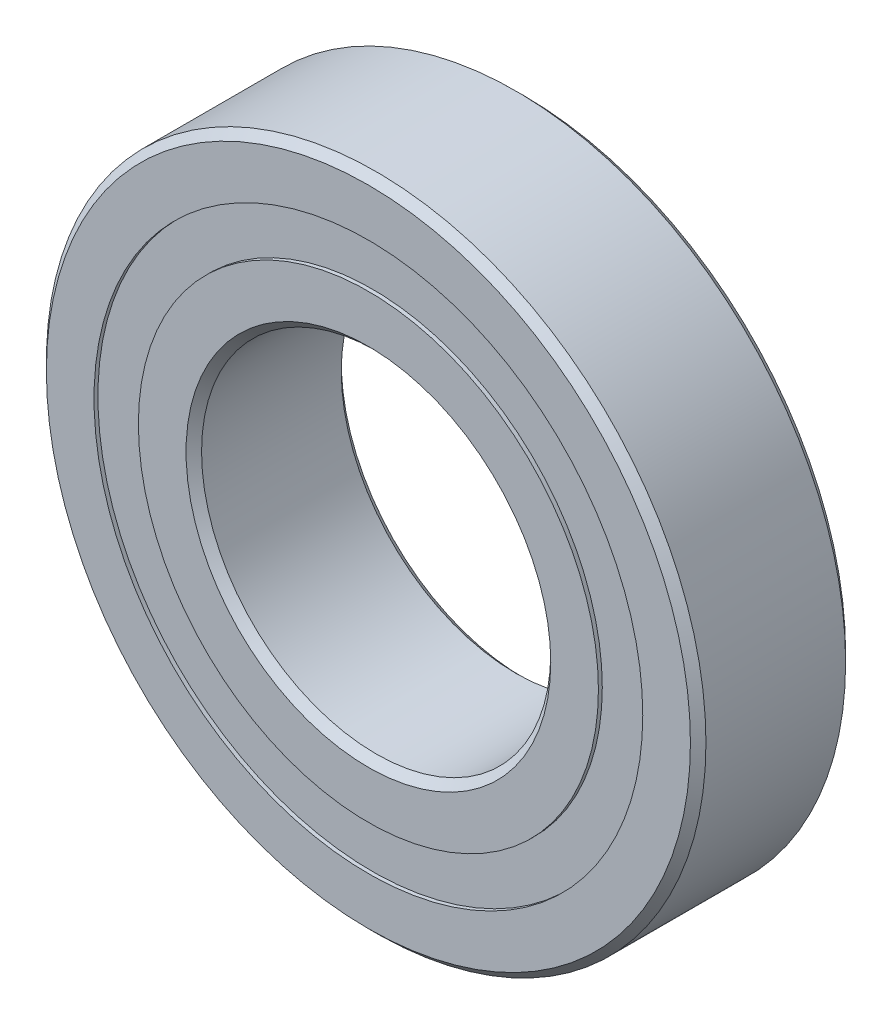
from build123d import *

# Parameters (mm, degrees)
CIRPATTERN1_COUNT = 12
SKETCH5_W         = 2.677418641
SKETCH5_H         = 3.628571428


with BuildPart() as part:
    # Sketch1 → Revolve1 (revolve)
    with BuildSketch(Plane(origin=(0, 0, 0), x_dir=(0, 0, -1), z_dir=(1, 0, 0))):
        with BuildLine():
            Line((5.715, 26.9875), (-5.715, 26.9875))
            Line((-5.715, 26.9875), (-6.35, 26.3525))
            Line((-6.35, 26.3525), (-6.35, 22.451785714))
            Line((-6.35, 22.451785714), (-2.822222222, 22.451785714))
            ThreePointArc((-2.822222222, 22.451785714), (0, 23.992581359), (2.822222222, 22.451785714))
            Line((2.822222222, 22.451785714), (6.35, 22.451785714))
            Line((6.35, 22.451785714), (6.35, 26.3525))
            Line((6.35, 26.3525), (5.715, 26.9875))
        make_face()
    revolve(axis=Axis((0, 0, 6.35), (0, 0, -1)))


with BuildPart() as body_2:
    # Sketch3 → Revolve3 (revolve)
    with BuildSketch(Plane(origin=(0, 0, 0), x_dir=(0, 0, -1), z_dir=(1, 0, 0))):
        with BuildLine():
            Line((-6.35, 18.823214286), (-2.822222222, 18.823214286))
            ThreePointArc((-2.822222222, 18.823214286), (0, 17.282418641), (2.822222222, 18.823214286))
            Line((2.822222222, 18.823214286), (6.35, 18.823214286))
            Line((6.35, 18.823214286), (6.35, 14.9225))
            Line((6.35, 14.9225), (5.715, 14.2875))
            Line((5.715, 14.2875), (-5.715, 14.2875))
            Line((-5.715, 14.2875), (-6.35, 14.9225))
            Line((-6.35, 14.9225), (-6.35, 18.823214286))
        make_face()
    revolve(axis=Axis((0, 0, 6.35), (0, 0, -1)))


with BuildPart() as body_3:
    # Sketch4 → Revolve4 (revolve)
    with BuildSketch(Plane(origin=(0, 0, 0), x_dir=(0, 0, -1), z_dir=(1, 0, 0))):
        with BuildLine():
            Line((-3.355081359, 20.6375), (3.355081359, 20.6375))
            ThreePointArc((3.355081359, 20.6375), (0, 23.992581359), (-3.355081359, 20.6375))
        make_face()
    revolve(axis=Axis((0, 20.6375, 3.355081359), (0, 0, -1)))


with BuildPart() as cirpattern1_1:
    # CirPattern1: pattern copy
    add(body_3.part.rotate(Axis((0, 0, -6.35), (0, 0, 1)), 1 * 360 / CIRPATTERN1_COUNT))


with BuildPart() as cirpattern1_2:
    # CirPattern1: pattern copy
    add(body_3.part.rotate(Axis((0, 0, -6.35), (0, 0, 1)), 2 * 360 / CIRPATTERN1_COUNT))


with BuildPart() as cirpattern1_3:
    # CirPattern1: pattern copy
    add(body_3.part.rotate(Axis((0, 0, -6.35), (0, 0, 1)), 3 * 360 / CIRPATTERN1_COUNT))


with BuildPart() as cirpattern1_4:
    # CirPattern1: pattern copy
    add(body_3.part.rotate(Axis((0, 0, -6.35), (0, 0, 1)), 4 * 360 / CIRPATTERN1_COUNT))


with BuildPart() as cirpattern1_5:
    # CirPattern1: pattern copy
    add(body_3.part.rotate(Axis((0, 0, -6.35), (0, 0, 1)), 5 * 360 / CIRPATTERN1_COUNT))


with BuildPart() as cirpattern1_6:
    # CirPattern1: pattern copy
    add(body_3.part.rotate(Axis((0, 0, -6.35), (0, 0, 1)), 6 * 360 / CIRPATTERN1_COUNT))


with BuildPart() as cirpattern1_7:
    # CirPattern1: pattern copy
    add(body_3.part.rotate(Axis((0, 0, -6.35), (0, 0, 1)), 7 * 360 / CIRPATTERN1_COUNT))


with BuildPart() as cirpattern1_8:
    # CirPattern1: pattern copy
    add(body_3.part.rotate(Axis((0, 0, -6.35), (0, 0, 1)), 8 * 360 / CIRPATTERN1_COUNT))


with BuildPart() as cirpattern1_9:
    # CirPattern1: pattern copy
    add(body_3.part.rotate(Axis((0, 0, -6.35), (0, 0, 1)), 9 * 360 / CIRPATTERN1_COUNT))


with BuildPart() as cirpattern1_10:
    # CirPattern1: pattern copy
    add(body_3.part.rotate(Axis((0, 0, -6.35), (0, 0, 1)), 10 * 360 / CIRPATTERN1_COUNT))


with BuildPart() as cirpattern1_11:
    # CirPattern1: pattern copy
    add(body_3.part.rotate(Axis((0, 0, -6.35), (0, 0, 1)), 11 * 360 / CIRPATTERN1_COUNT))


with BuildPart() as body_15:
    # Sketch5 → Revolve5 (revolve)
    with BuildSketch(Plane(origin=(0, 0, 0), x_dir=(0, 0, -1), z_dir=(1, 0, 0))):
        with Locations((-4.69379068, 20.6375)):
            Rectangle(SKETCH5_W, SKETCH5_H)
        with Locations((4.69379068, 20.6375)):
            Rectangle(SKETCH5_W, SKETCH5_H)
    revolve(axis=Axis((0, 0, 6.35), (0, 0, -1)))


solid = Compound([part.part, body_2.part, body_3.part, cirpattern1_1.part, cirpattern1_2.part, cirpattern1_3.part, cirpattern1_4.part, cirpattern1_5.part, cirpattern1_6.part, cirpattern1_7.part, cirpattern1_8.part, cirpattern1_9.part, cirpattern1_10.part, cirpattern1_11.part, body_15.part])
